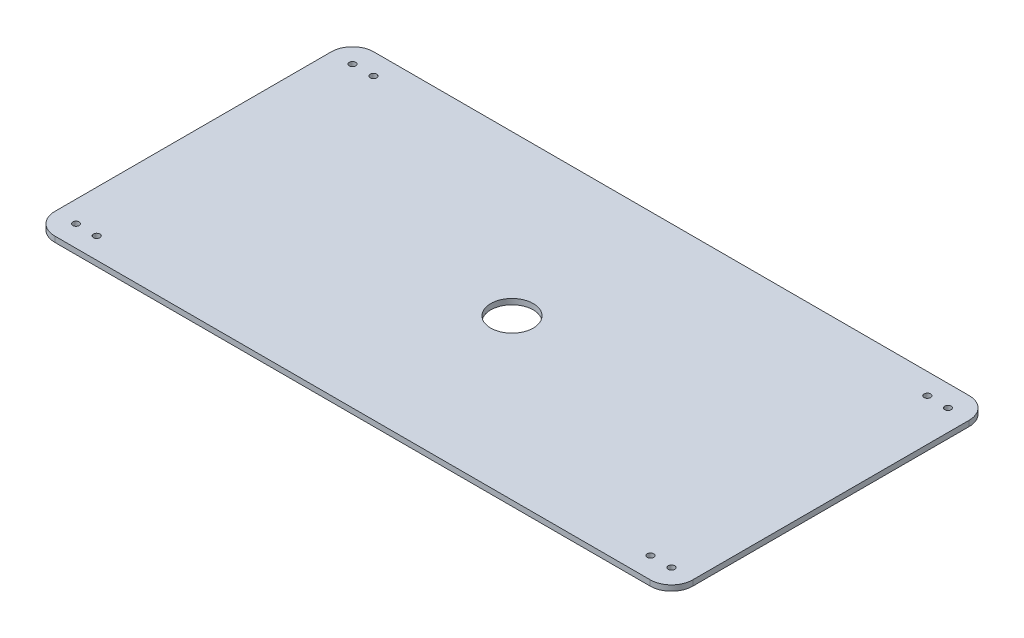
from build123d import *

# Parameters (mm, degrees)
SKETCH1_W               = 300
SKETCH1_H               = 150
BOSS_EXTRUDE1_DEPTH     = 2.6
FILLET1_R               = 10
SKETCH6_R               = 1.5
CUT_EXTRUDE6_DEPTH      = 2.6
MIRROR6_COPY_1_SKETCH_R = 1.5
MIRROR6_COPY_1_DEPTH    = 2.6
SKETCH15_R              = 10
CUT_EXTRUDE14_DEPTH     = 336.420273687
SKETCH23_R              = 1.524
CUT_EXTRUDE16_DEPTH     = 2.59999988
MIRROR8_COPY_1_SKETCH_R = 1.524
MIRROR8_COPY_1_DEPTH    = 2.59999988


with BuildPart() as part:
    # Sketch1 → Boss-Extrude1 (new body)
    with BuildSketch(Plane(origin=(0, 0, 0), x_dir=(1, 0, 0), z_dir=(0, 1, 0))):
        with Locations((150, -75)):
            Rectangle(SKETCH1_W, SKETCH1_H)
    extrude(amount=BOSS_EXTRUDE1_DEPTH)

    # Fillet1
    fillet1_edges = [part.edges().sort_by_distance(p)[0] for p in [
        (0, 1.3, 0),
        (300, 1.3, 0),
        (300, 1.3, 150),
        (0, 1.3, 150),
    ]]
    fillet(fillet1_edges, radius=FILLET1_R)

    # Sketch6 → Cut-Extrude6 (cut)
    with BuildSketch(Plane.XZ):
        with Locations(Location((290, 10, 0), (0, 0, 270))):
            Circle(SKETCH6_R)
    cut_extrude6 = extrude(amount=-CUT_EXTRUDE6_DEPTH, mode=Mode.SUBTRACT)

    # Mirror5: Cut-Extrude6 across plane
    add(cut_extrude6.mirror(Plane(origin=(150, 0, 0), x_dir=(0, 0, 1), z_dir=(1, 0, 0))), mode=Mode.SUBTRACT)

    # Mirror6: Cut-Extrude6 across plane
    add(cut_extrude6.mirror(Plane.XY.offset(75)), mode=Mode.SUBTRACT)

    # Mirror6 copy 1 sketch → Mirror6 copy 1 (cut)
    with BuildSketch(Plane(origin=(300, 0, 150), x_dir=(-1, 0, 0), z_dir=(0, -1, 0))):
        with Locations(Location((290, 10, 0), (0, 0, 270))):
            Circle(MIRROR6_COPY_1_SKETCH_R)
    extrude(amount=-MIRROR6_COPY_1_DEPTH, mode=Mode.SUBTRACT)

    # Sketch15 → Cut-Extrude14 (cut, through all)
    with BuildSketch(Plane.XZ):
        with Locations(Location((150, 75, 0), (0, 0, 270))):
            Circle(SKETCH15_R)
    extrude(amount=-CUT_EXTRUDE14_DEPTH, mode=Mode.SUBTRACT)

    # Sketch23 → Cut-Extrude16 (cut)
    with BuildSketch(Plane(origin=(0, 2.6, 0), x_dir=(1, 0, 0), z_dir=(0, 1, 0))):
        with Locations(Location((19.812, -9.906, 0), (0, 0, 270))):
            Circle(SKETCH23_R)
    cut_extrude16 = extrude(amount=-CUT_EXTRUDE16_DEPTH, mode=Mode.SUBTRACT)

    # Mirror7: Cut-Extrude16 across plane
    add(cut_extrude16.mirror(Plane(origin=(150, 0, 0), x_dir=(0, 0, 1), z_dir=(1, 0, 0))), mode=Mode.SUBTRACT)

    # Mirror8: Cut-Extrude16 across plane
    add(cut_extrude16.mirror(Plane.XY.offset(75)), mode=Mode.SUBTRACT)

    # Mirror8 copy 1 sketch → Mirror8 copy 1 (cut)
    with BuildSketch(Plane(origin=(300, 2.6, 150), x_dir=(-1, 0, 0), z_dir=(0, 1, 0))):
        with Locations(Location((19.812, -9.906, 0), (0, 0, 270))):
            Circle(MIRROR8_COPY_1_SKETCH_R)
    extrude(amount=-MIRROR8_COPY_1_DEPTH, mode=Mode.SUBTRACT)


solid = part.part
